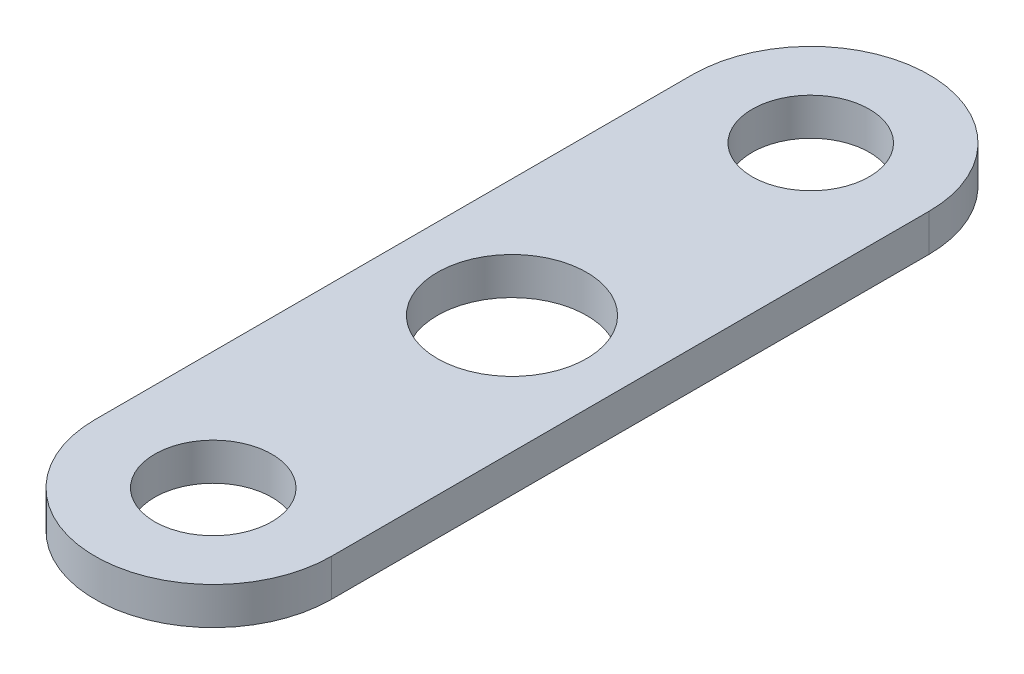
from build123d import *

# Parameters (mm, degrees)
SKETCH1_R           = 3.175
SKETCH1_R_2         = 2.4892
BOSS_EXTRUDE1_DEPTH = 1.5875


with BuildPart() as part:
    # Sketch1 → Boss-Extrude1 (new body)
    with BuildSketch(Plane(origin=(0, 0, 0), x_dir=(1, 0, 0), z_dir=(0, 1, 0))):
        with BuildLine():
            Line((5.0292, -12.7), (5.0292, 12.7))
            ThreePointArc((5.0292, 12.7), (0, 17.7292), (-5.0292, 12.7))
            Line((-5.0292, 12.7), (-5.0292, -12.7))
            ThreePointArc((-5.0292, -12.7), (0, -17.7292), (5.0292, -12.7))
        make_face()
        with Locations(Location((0, 0, 0), (0, 0, 270))):
            Circle(SKETCH1_R, mode=Mode.SUBTRACT)
        with Locations(Location((0, 12.7, 0), (0, 0, 270))):
            Circle(SKETCH1_R_2, mode=Mode.SUBTRACT)
        with Locations(Location((0, -12.7, 0), (0, 0, 270))):
            Circle(SKETCH1_R_2, mode=Mode.SUBTRACT)
    extrude(amount=BOSS_EXTRUDE1_DEPTH)


solid = part.part
